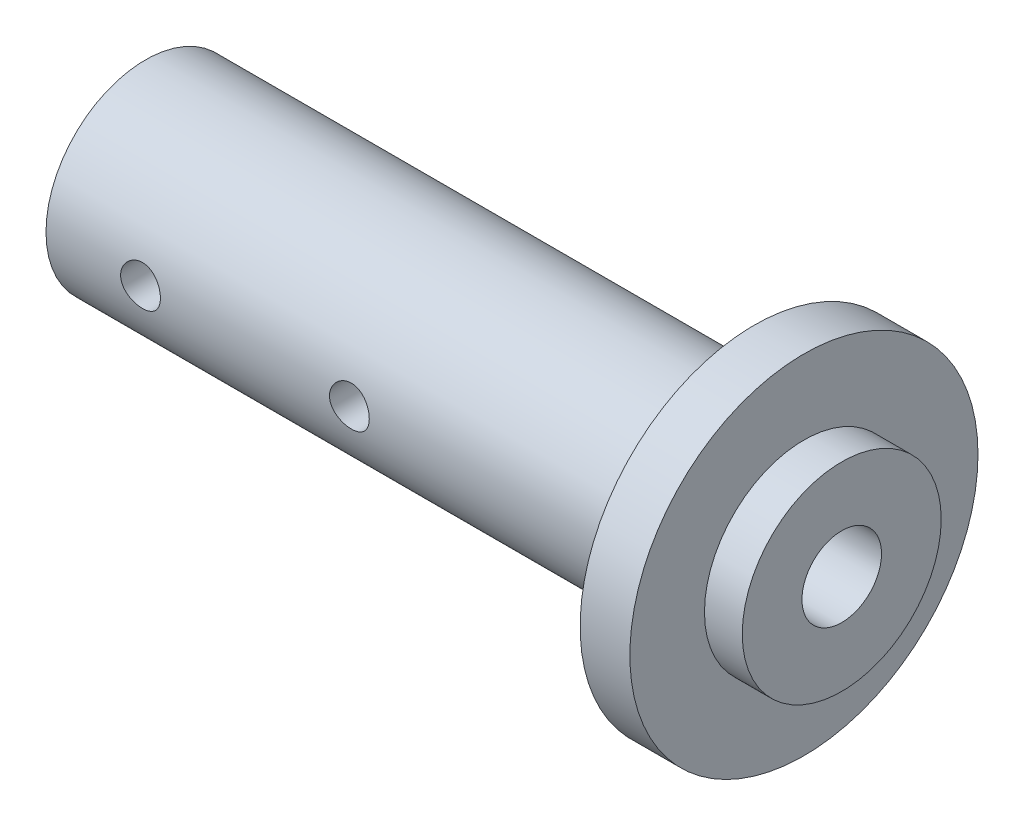
from build123d import *

# Parameters (mm, degrees)
CUT_EXTRUDE2_DEPTH      = 75.246212025
CUT_EXTRUDE2_DEPTH_BACK = 75.246212025
SKETCH5_R               = 2


with BuildPart() as part:
    # Sketch1 → Revolve2 (revolve)
    with BuildSketch(Plane(origin=(0, 0, 0), x_dir=(1, 0, 0), z_dir=(0, 1, 0))):
        Polygon((-3.8, 10), (-3.8, 17.5), (-8.8, 17.5), (-8.8, 10), (-70, 10), (-70, 0), (-19, 0), (-19, 4), (0, 4), (0, 10), align=None)
    revolve(axis=Axis((0, 0, 0), (-1, 0, 0)))

    # Sketch5 → Cut-Extrude2 (cut, two sides: drawn at the far end of the back side and taken through both)
    with BuildSketch(Plane.XY.offset(-CUT_EXTRUDE2_DEPTH_BACK)):
        with Locations((-39.5, 0)):
            Circle(SKETCH5_R)
        with Locations((-60.5, 0)):
            Circle(SKETCH5_R)
    extrude(amount=CUT_EXTRUDE2_DEPTH + CUT_EXTRUDE2_DEPTH_BACK, mode=Mode.SUBTRACT)


solid = part.part
